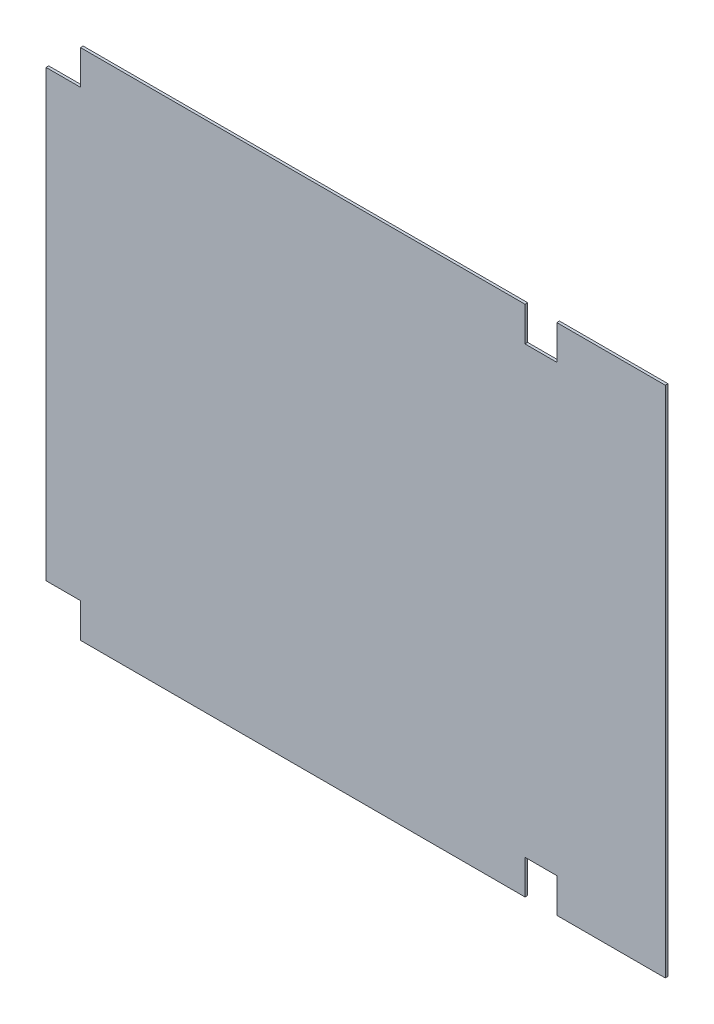
from build123d import *

# Parameters (mm, degrees)
SKETCH1_W           = 742.95
SKETCH1_H           = 615.95
BOSS_EXTRUDE1_DEPTH = 3.175
SKETCH2_W           = 41.275
SKETCH2_H           = 41.275
SKETCH2_W_2         = 38.1
CUT_EXTRUDE1_DEPTH  = 483.54777678


with BuildPart() as part:
    # Sketch1 → Boss-Extrude1 (new body)
    with BuildSketch(Plane.XY):
        Rectangle(SKETCH1_W, SKETCH1_H)
    extrude(amount=BOSS_EXTRUDE1_DEPTH)

    # Sketch2 → Cut-Extrude1 (cut, through all)
    with BuildSketch(Plane.XY.offset(3.175)):
        with Locations((-350.8375, 287.3375)):
            Rectangle(SKETCH2_W, SKETCH2_H)
        with Locations((-350.8375, -287.3375)):
            Rectangle(SKETCH2_W, SKETCH2_H)
        with Locations((222.25, 287.3375)):
            Rectangle(SKETCH2_W_2, SKETCH2_H)
        with Locations((222.25, -287.3375)):
            Rectangle(SKETCH2_W_2, SKETCH2_H)
    extrude(amount=-CUT_EXTRUDE1_DEPTH, mode=Mode.SUBTRACT)


solid = part.part
